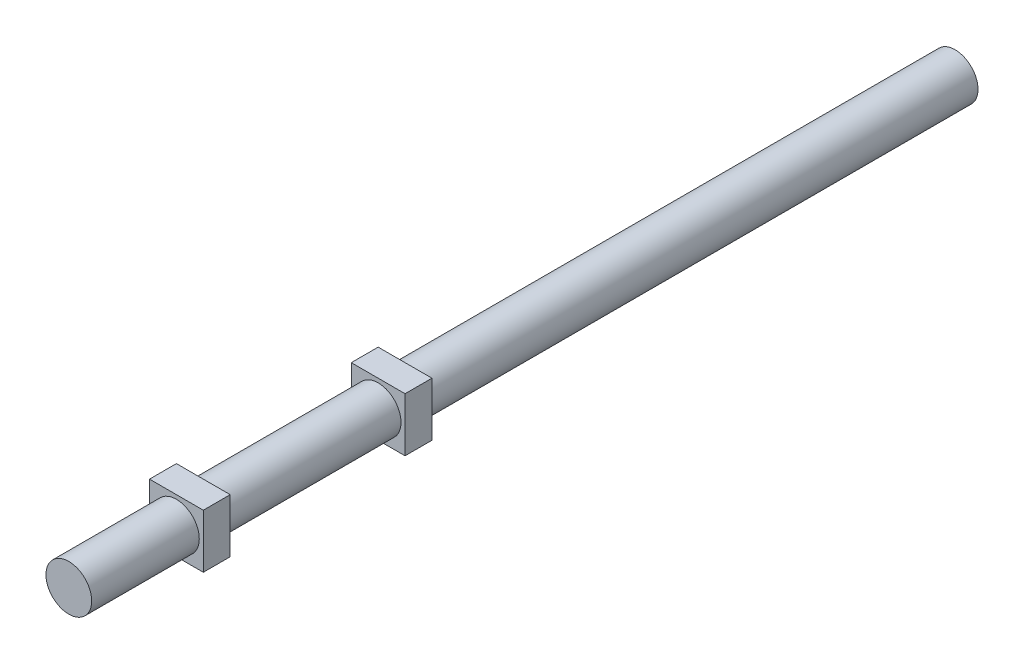
from build123d import *

# Parameters (mm, degrees)
SKETCH1_R           = 8.5
BOSS_EXTRUDE1_DEPTH = 329.5
SKETCH2_W           = 20
SKETCH2_H           = 20
BOSS_EXTRUDE2_DEPTH = 10
SKETCH3_W           = 20
SKETCH3_H           = 20
BOSS_EXTRUDE3_DEPTH = 10


with BuildPart() as part:
    # Sketch1 → Boss-Extrude1 (new body)
    with BuildSketch(Plane.XY):
        Circle(SKETCH1_R)
    extrude(amount=BOSS_EXTRUDE1_DEPTH)

    # Sketch2 → Boss-Extrude2 (add)
    with BuildSketch(Plane.XY.offset(279.5)):
        Rectangle(SKETCH2_W, SKETCH2_H)
    extrude(amount=BOSS_EXTRUDE2_DEPTH)

    # Sketch3 → Boss-Extrude3 (add)
    with BuildSketch(Plane.XY.offset(204.5)):
        Rectangle(SKETCH3_W, SKETCH3_H)
    extrude(amount=BOSS_EXTRUDE3_DEPTH)


solid = part.part
